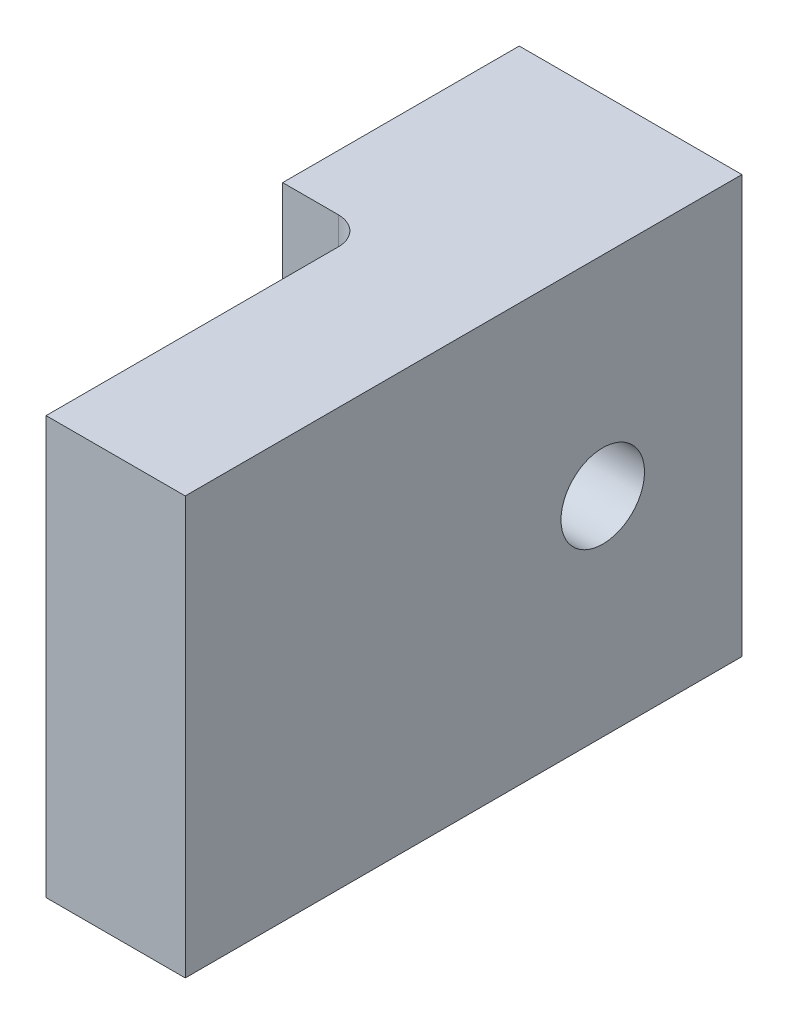
from build123d import *

# Parameters (mm, degrees)
EXTRUDE_1_DEPTH     = 15
CUT_EXTRUDE_1_DEPTH = 15
FILLET_1_R          = 1


with BuildPart() as part:
    # 草图1 → 凸台-拉伸1 (new body)
    with BuildSketch(Plane(origin=(0, 0, 0), x_dir=(1, 0, 0), z_dir=(0, 1, 0))):
        Polygon((-5.74789916, 13.058823529), (2.25210084, 13.058823529), (2.25210084, -6.941176471), (-2.74789916, -6.941176471), (-2.74789916, 4.558823529), (-5.74789916, 4.558823529), align=None)
    extrude(amount=EXTRUDE_1_DEPTH)

    # 草图2 → 切除-拉伸1 (cut)
    with BuildSketch(Plane.ZY.offset(5.74789916)):
        with BuildLine():
            ThreePointArc((-6.558823529, 7.5), (-8.058823529, 9), (-9.558823529, 7.5))
            Line((-9.558823529, 7.5), (-6.558823529, 7.5))
        make_face()
        with BuildLine():
            Line((-6.558823529, 7.5), (-9.558823529, 7.5))
            ThreePointArc((-9.558823529, 7.5), (-8.058823529, 6), (-6.558823529, 7.5))
        make_face()
    extrude(amount=-CUT_EXTRUDE_1_DEPTH, mode=Mode.SUBTRACT)

    # 圆角1
    fillet_1_edges = [part.edges().sort_by_distance(p)[0] for p in [
        (-2.74789916, 7.5, -4.558823529),
    ]]
    fillet(fillet_1_edges, radius=FILLET_1_R)


solid = part.part
